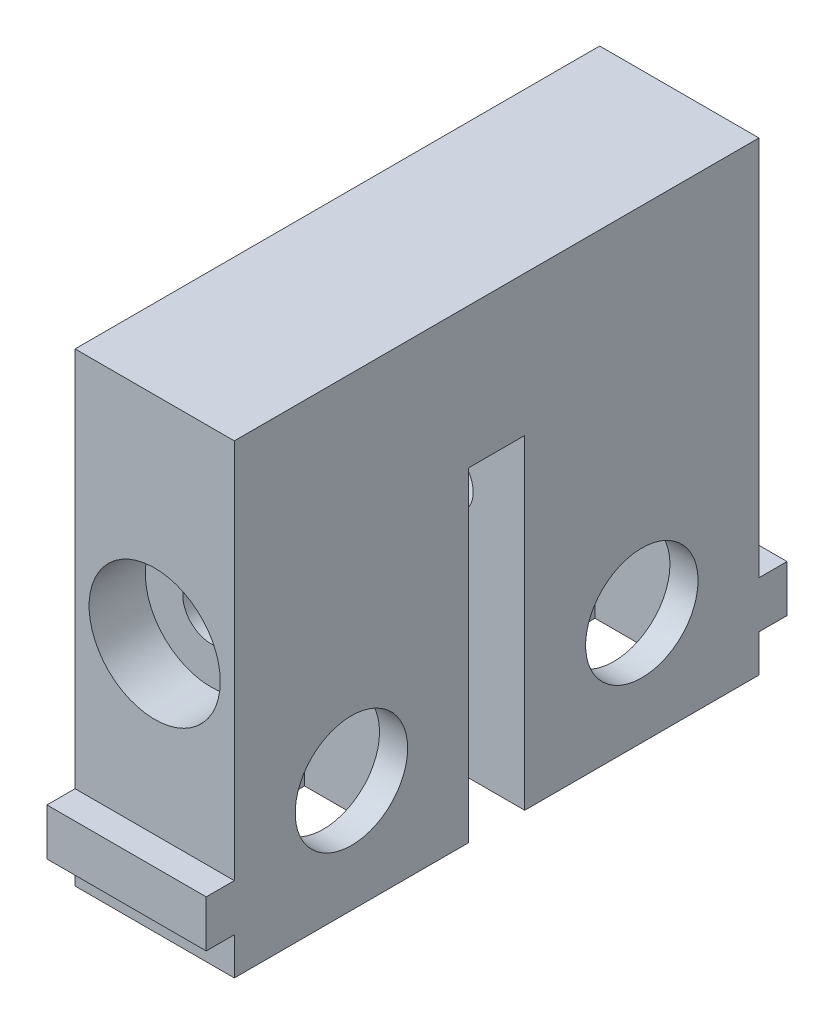
from build123d import *

# Parameters (mm, degrees)
BOSS_EXTRUDE2_DEPTH      = 8.5
BOSS_EXTRUDE2_DEPTH_BACK = 8.5
SKETCH1_R                = 6
CUT_EXTRUDE1_DEPTH       = 5.5
CUT_EXTRUDE1_DEPTH_BACK  = 5.5
SKETCH1_4_R              = 6
CUT_EXTRUDE2_DEPTH       = 68.492341935
CUT_EXTRUDE2_DEPTH_BACK  = 68.492341935
SKETCH3_R                = 3
SKETCH3_3_R              = 7
SKETCH3_3_R_2            = 3
CUT_EXTRUDE3_DEPTH       = 6
CUT_EXTRUDE4_DEPTH       = 10


with BuildPart() as part:
    # Sketch1 → Boss-Extrude2 (new, two sides: drawn at the far end of the back side and taken through both)
    with BuildSketch(Plane(origin=(0, 0, 0), x_dir=(0, 0, -1), z_dir=(1, 0, 0)).offset(-BOSS_EXTRUDE2_DEPTH_BACK)):
        Polygon((-28, -22.65385), (-31, -22.65385), (-31, -27.65385), (-28, -27.65385), (-28, -31.65385), (-3, -31.65385), (-3, 3), (3, 3), (3, -31.65385), (28, -31.65385), (28, -27.65385), (31, -27.65385), (31, -22.65385), (28, -22.65385), (28, 18), (-28, 18), align=None)
        with Locations((15.5, -19.65385)):
            Circle(SKETCH1_R, mode=Mode.SUBTRACT)
        with Locations((-15.5, -19.65385)):
            Circle(SKETCH1_R, mode=Mode.SUBTRACT)
    extrude(amount=BOSS_EXTRUDE2_DEPTH + BOSS_EXTRUDE2_DEPTH_BACK)

    # Sketch1<4> → Cut-Extrude1 (cut, two sides: drawn at the far end of the back side and taken through both)
    # profile 1 of 2: a face of its own
    with BuildSketch(Plane(origin=(0, 0, 0), x_dir=(0, 0, -1), z_dir=(1, 0, 0)).offset(-CUT_EXTRUDE1_DEPTH_BACK)):
        Polygon((-24.5, -14.457697577), (-24.5, -31.65385), (-6.5, -31.65385), (-6.5, -14.457697577), (-15.5, -9.261545155), align=None)
        with Locations((-15.5, -19.65385)):
            Circle(SKETCH1_4_R, mode=Mode.SUBTRACT)
    # profile 2 of 2: a face of its own
    with BuildSketch(Plane(origin=(0, 0, 0), x_dir=(0, 0, -1), z_dir=(1, 0, 0)).offset(-CUT_EXTRUDE1_DEPTH_BACK)):
        Polygon((6.5, -31.65385), (24.5, -31.65385), (24.5, -14.457697577), (15.5, -9.261545155), (6.5, -14.457697577), align=None)
        with Locations((15.5, -19.65385)):
            Circle(SKETCH1_4_R, mode=Mode.SUBTRACT)
    extrude(amount=CUT_EXTRUDE1_DEPTH + CUT_EXTRUDE1_DEPTH_BACK, mode=Mode.SUBTRACT)

    # Sketch3 → Cut-Extrude2 (cut, two sides: drawn at the far end of the back side and taken through both)
    with BuildSketch(Plane.XY.offset(28).offset(-CUT_EXTRUDE2_DEPTH_BACK)):
        with Locations((0, -5)):
            Circle(SKETCH3_R)
    extrude(amount=CUT_EXTRUDE2_DEPTH + CUT_EXTRUDE2_DEPTH_BACK, mode=Mode.SUBTRACT)

    # Sketch3<3> → Cut-Extrude3 (cut)
    with BuildSketch(Plane.XY.offset(28)):
        with Locations((0, -5)):
            Circle(SKETCH3_3_R)
        with Locations((0, -5)):
            Circle(SKETCH3_3_R_2, mode=Mode.SUBTRACT)
    extrude(amount=-CUT_EXTRUDE3_DEPTH, mode=Mode.SUBTRACT)

    # Sketch4 → Cut-Extrude4 (cut)
    with BuildSketch(Plane(origin=(0, 0, -28), x_dir=(-1, 0, 0), z_dir=(0, 0, -1))):
        Polygon((5.773502692, -5), (2.886751346, 0), (-2.886751346, 0), (-5.773502692, -5), (-2.886751346, -10), (2.886751346, -10), align=None)
    extrude(amount=-CUT_EXTRUDE4_DEPTH, mode=Mode.SUBTRACT)


solid = part.part
